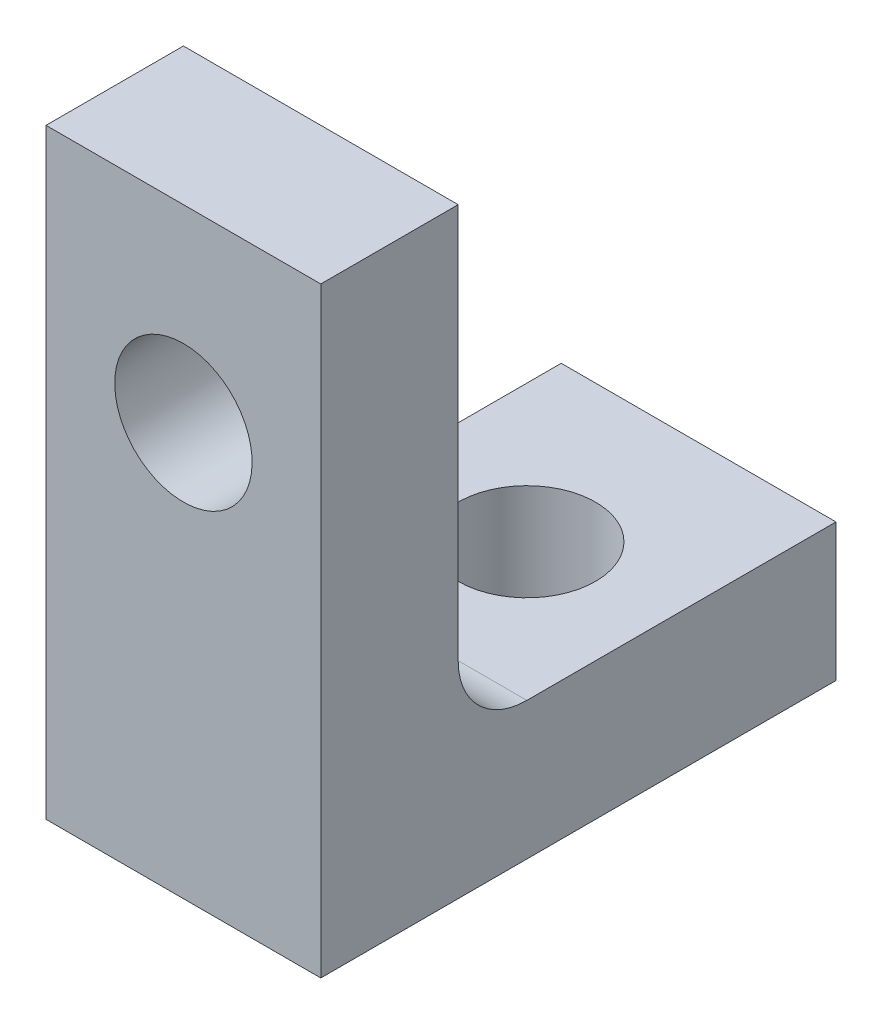
from build123d import *

# Parameters (mm, degrees)
BOSS_EXTRUDE1_DEPTH = 4
SKETCH2_R           = 1
CUT_EXTRUDE1_DEPTH  = 10.581883948
SKETCH3_R           = 1
CUT_EXTRUDE2_DEPTH  = 10.581883948
FILLET1_R           = 1


with BuildPart() as part:
    # Sketch1 → Boss-Extrude1 (new body)
    with BuildSketch(Plane(origin=(0, 0, 0), x_dir=(0, 0, -1), z_dir=(1, 0, 0))):
        Polygon((0, 0), (0, 6.75), (-2, 6.75), (-2, -2), (5.5, -2), (5.5, 0), align=None)
    extrude(amount=BOSS_EXTRUDE1_DEPTH)

    # Sketch2 → Cut-Extrude1 (cut, through all)
    with BuildSketch(Plane(origin=(0, 0, 0), x_dir=(-1, 0, 0), z_dir=(0, 0, -1))):
        with Locations(Location((-2, 4, 0), (0, 0, 90))):
            Circle(SKETCH2_R)
    extrude(amount=-CUT_EXTRUDE1_DEPTH, mode=Mode.SUBTRACT)

    # Sketch3 → Cut-Extrude2 (cut, through all)
    with BuildSketch(Plane(origin=(0, 0, 0), x_dir=(1, 0, 0), z_dir=(0, 1, 0))):
        with Locations(Location((2, 3, 0), (0, 0, 270))):
            Circle(SKETCH3_R)
    extrude(amount=-CUT_EXTRUDE2_DEPTH, mode=Mode.SUBTRACT)

    # Fillet1
    fillet1_edges = [part.edges().sort_by_distance(p)[0] for p in [
        (2, 0, 0),
    ]]
    fillet(fillet1_edges, radius=FILLET1_R)


solid = part.part
